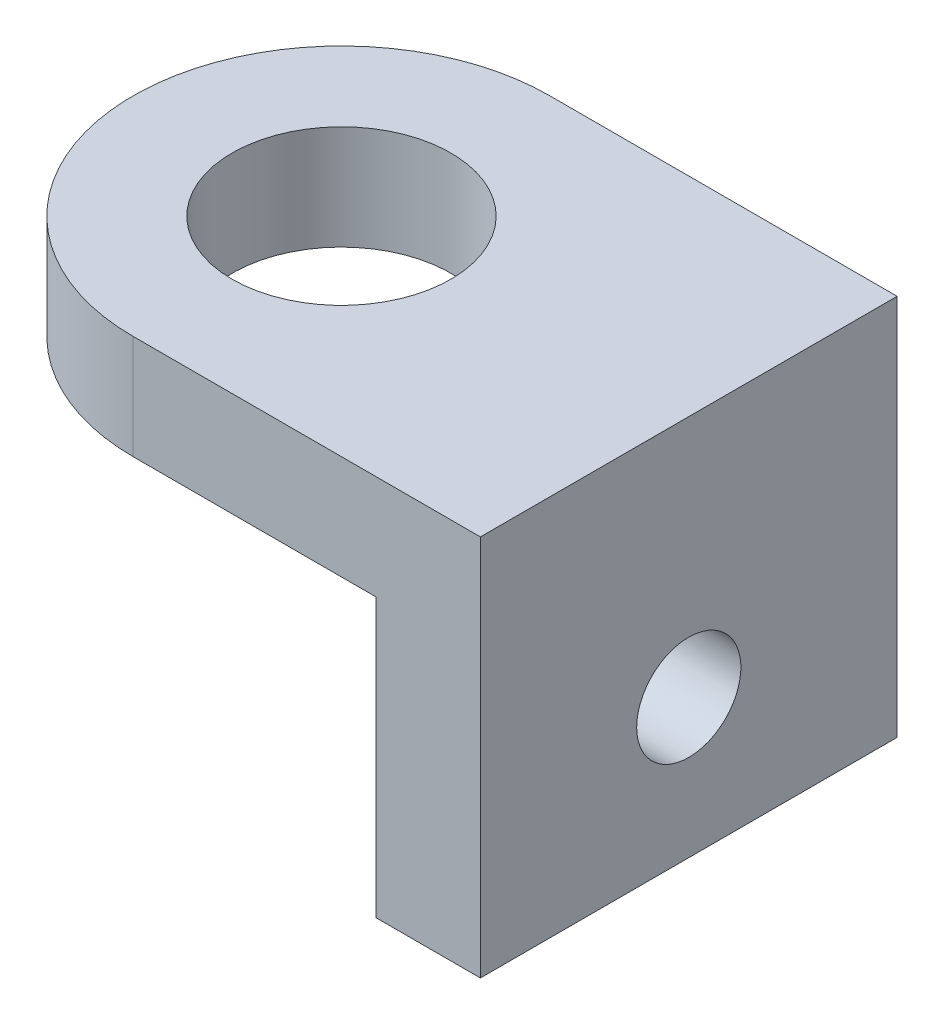
from build123d import *

# Parameters (mm, degrees)
SKETCH2_R           = 3.15
BOSS_EXTRUDE1_DEPTH = 3
SKETCH2_3_W         = 3
SKETCH2_3_H         = 12
BOSS_EXTRUDE2_DEPTH = 8
SKETCH4_R           = 1.5
CUT_EXTRUDE1_DEPTH  = 17.401219467


with BuildPart() as part:
    # Sketch2 → Boss-Extrude1 (new body)
    with BuildSketch(Plane(origin=(0, 0, 0), x_dir=(1, 0, 0), z_dir=(0, 1, 0))):
        with BuildLine():
            Line((0, -6), (10, -6))
            Line((10, -6), (10, 6))
            Line((10, 6), (0, 6))
            ThreePointArc((0, 6), (-6, 0), (0, -6))
        make_face()
        Circle(SKETCH2_R, mode=Mode.SUBTRACT)
    extrude(amount=BOSS_EXTRUDE1_DEPTH)

    # Sketch2<3> → Boss-Extrude2 (add)
    with BuildSketch(Plane(origin=(0, 0, 0), x_dir=(1, 0, 0), z_dir=(0, 1, 0))):
        with Locations((8.5, 0)):
            Rectangle(SKETCH2_3_W, SKETCH2_3_H)
    extrude(amount=-BOSS_EXTRUDE2_DEPTH)

    # Sketch4 → Cut-Extrude1 (cut, through all)
    with BuildSketch(Plane.ZY.offset(-7)):
        with Locations((0, -4)):
            Circle(SKETCH4_R)
    extrude(amount=-CUT_EXTRUDE1_DEPTH, mode=Mode.SUBTRACT)


solid = part.part
